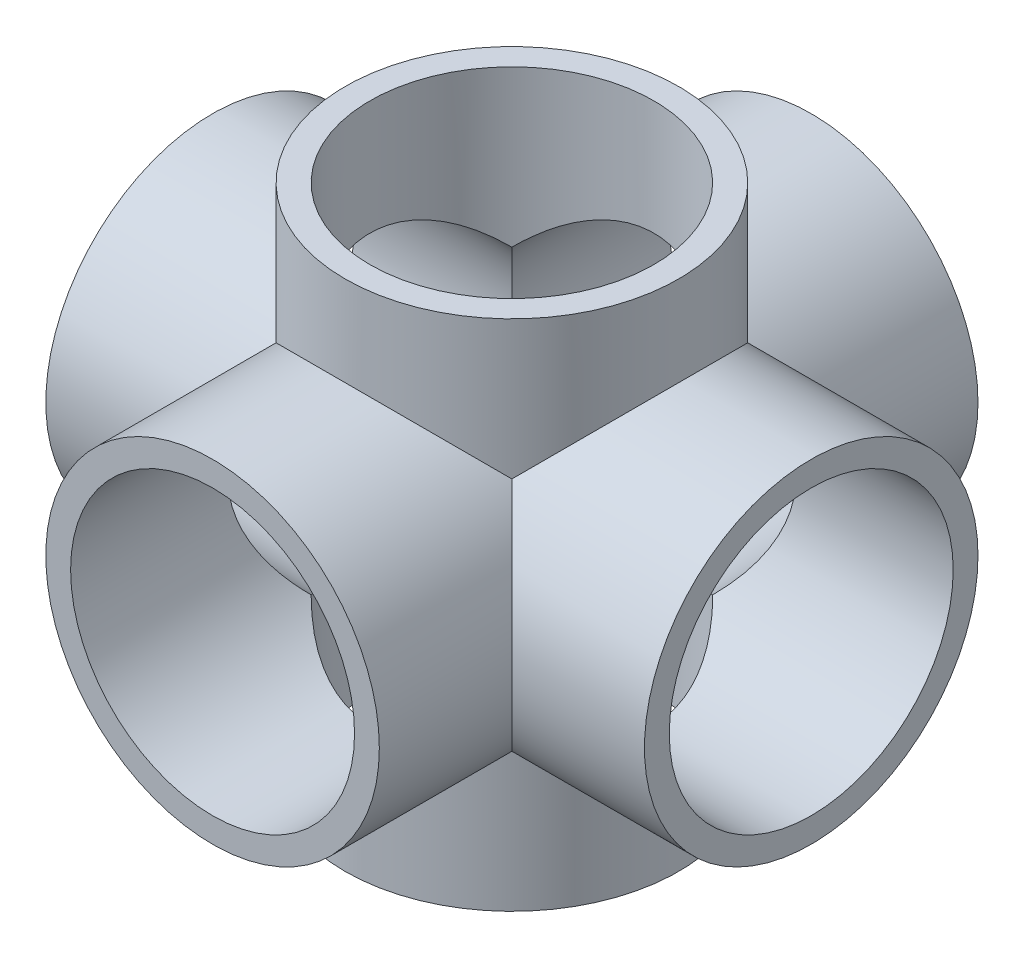
from build123d import *

# Parameters (mm, degrees)
CROQUIS1_R                   = 19.5
CROQUIS1_R_2                 = 16.6
SALIENTE_EXTRUIR1_DEPTH      = 60
SALIENTE_EXTRUIR3_DEPTH      = 35
SALIENTE_EXTRUIR3_DEPTH_BACK = 35
CROQUIS2_R                   = 19.5
CROQUIS2_R_2                 = 16.6
SALIENTE_EXTRUIR4_DEPTH      = 35
SALIENTE_EXTRUIR4_DEPTH_BACK = 35
CROQUIS3_R                   = 19.5
CROQUIS3_R_2                 = 16.6
CORTAR_EXTRUIR1_DEPTH        = 35
CORTAR_EXTRUIR1_DEPTH_BACK   = 35
CORTAR_EXTRUIR2_DEPTH        = 35
CORTAR_EXTRUIR2_DEPTH_BACK   = 35
CROQUIS7_R                   = 16.6
CORTAR_EXTRUIR3_DEPTH        = 60


with BuildPart() as part:
    # Croquis1 → Saliente-Extruir1 (new body)
    with BuildSketch(Plane(origin=(0, 0, 0), x_dir=(1, 0, 0), z_dir=(0, 1, 0))):
        Circle(CROQUIS1_R)
        Circle(CROQUIS1_R_2, mode=Mode.SUBTRACT)
    extrude(amount=SALIENTE_EXTRUIR1_DEPTH)

    # Croquis2 → Saliente-Extruir3 (add, two sides: drawn at the far end of the back side and taken through both)
    with BuildSketch(Plane(origin=(0, 0, 0), x_dir=(0, 0, -1), z_dir=(1, 0, 0)).offset(-SALIENTE_EXTRUIR3_DEPTH_BACK)):
        with Locations((0, 30)):
            Circle(CROQUIS2_R)
        with Locations((0, 30)):
            Circle(CROQUIS2_R_2, mode=Mode.SUBTRACT)
    extrude(amount=SALIENTE_EXTRUIR3_DEPTH + SALIENTE_EXTRUIR3_DEPTH_BACK)

    # Croquis3 → Saliente-Extruir4 (add, two sides: drawn at the far end of the back side and taken through both)
    with BuildSketch(Plane.XY.offset(-SALIENTE_EXTRUIR4_DEPTH_BACK)):
        with Locations((0, 30)):
            Circle(CROQUIS3_R)
        with Locations((0, 30)):
            Circle(CROQUIS3_R_2, mode=Mode.SUBTRACT)
    extrude(amount=SALIENTE_EXTRUIR4_DEPTH + SALIENTE_EXTRUIR4_DEPTH_BACK)

    # Croquis5 → Cortar-Extruir1 (cut, two sides: drawn at the far end of the back side and taken through both)
    with BuildSketch(Plane(origin=(0, 0, 0), x_dir=(0, 0, -1), z_dir=(1, 0, 0)).offset(-CORTAR_EXTRUIR1_DEPTH_BACK)):
        with BuildLine():
            ThreePointArc((0, 46.6), (-11.737972568, 18.262027432), (16.6, 30))
            ThreePointArc((16.6, 30), (11.737972568, 41.737972568), (0, 46.6))
        make_face()
    extrude(amount=CORTAR_EXTRUIR1_DEPTH + CORTAR_EXTRUIR1_DEPTH_BACK, mode=Mode.SUBTRACT)

    # Croquis6 → Cortar-Extruir2 (cut, two sides: drawn at the far end of the back side and taken through both)
    with BuildSketch(Plane.XY.offset(-CORTAR_EXTRUIR2_DEPTH_BACK)):
        with BuildLine():
            ThreePointArc((0, 46.6), (-11.737972568, 18.262027432), (16.6, 30))
            ThreePointArc((16.6, 30), (11.737972568, 41.737972568), (0, 46.6))
        make_face()
    extrude(amount=CORTAR_EXTRUIR2_DEPTH + CORTAR_EXTRUIR2_DEPTH_BACK, mode=Mode.SUBTRACT)

    # Croquis7 → Cortar-Extruir3 (cut)
    with BuildSketch(Plane(origin=(0, 0, 0), x_dir=(1, 0, 0), z_dir=(0, 1, 0))):
        Circle(CROQUIS7_R)
    extrude(amount=CORTAR_EXTRUIR3_DEPTH, mode=Mode.SUBTRACT)


solid = part.part
